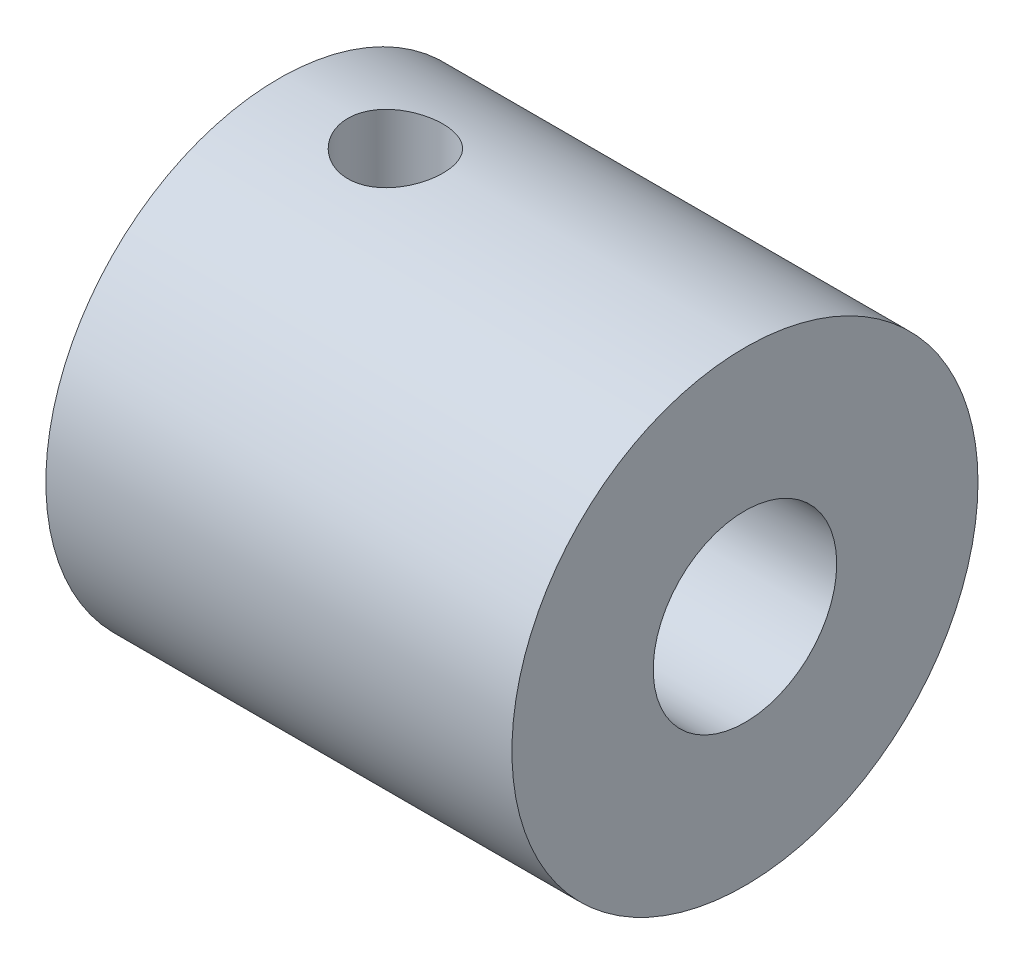
from build123d import *

# Parameters (mm, degrees)
SKETCH1_R           = 12.7
BOSS_EXTRUDE1_DEPTH = 25.4
SKETCH2_R           = 3
CUT_EXTRUDE1_DEPTH  = 9.525
SKETCH3_R           = 5
CUT_EXTRUDE2_DEPTH  = 9.525


with BuildPart() as part:
    # Sketch1 → Boss-Extrude1 (new body)
    with BuildSketch(Plane(origin=(0, 0, 0), x_dir=(0, 0, -1), z_dir=(1, 0, 0))):
        Circle(SKETCH1_R)
    extrude(amount=BOSS_EXTRUDE1_DEPTH)

    # Sketch2 → Cut-Extrude1 (cut)
    with BuildSketch(Plane.ZY):
        Circle(SKETCH2_R)
    extrude(amount=-CUT_EXTRUDE1_DEPTH, mode=Mode.SUBTRACT)

    # Sketch7 → #6 (0.204) Diameter Hole1 (revolve, cut)
    with BuildSketch(Plane(origin=(6.35, 0, 0), x_dir=(0, 0, -1), z_dir=(1, 0, 0))):
        Polygon((0, 0), (0, 16.288709692), (2.5908, 14.732), (2.5908, 0), align=None)
    revolve(axis=Axis((6.35, -6.35, 0), (0, 1, 0)), mode=Mode.SUBTRACT)

    # Sketch3 → Cut-Extrude2 (cut)
    with BuildSketch(Plane(origin=(25.4, 0, 0), x_dir=(0, 0, -1), z_dir=(1, 0, 0))):
        Circle(SKETCH3_R)
    extrude(amount=-CUT_EXTRUDE2_DEPTH, mode=Mode.SUBTRACT)


solid = part.part
